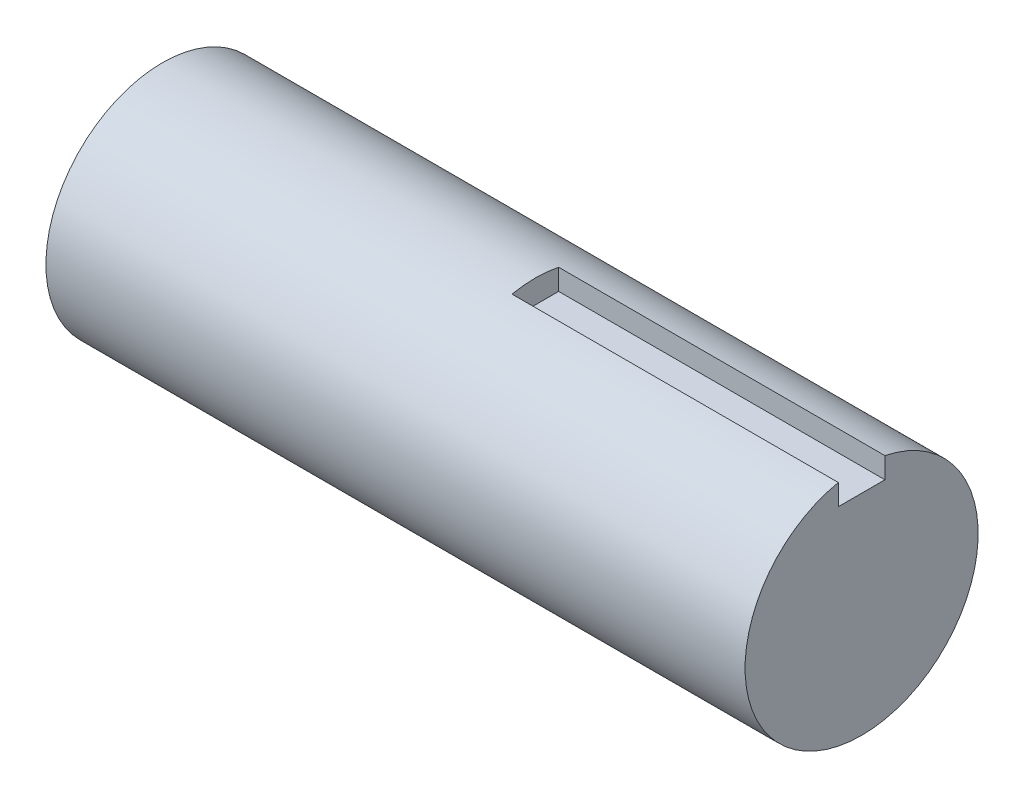
from build123d import *

# Parameters (mm, degrees)
SKETCH1_R           = 25
BOSS_EXTRUDE1_DEPTH = 150
SKETCH2_W           = 10
SKETCH2_H           = 10
CUT_EXTRUDE1_DEPTH  = 70


with BuildPart() as part:
    # Sketch1 → Boss-Extrude1 (new body)
    with BuildSketch(Plane(origin=(0, 0, 0), x_dir=(0, 0, -1), z_dir=(1, 0, 0))):
        Circle(SKETCH1_R)
    extrude(amount=BOSS_EXTRUDE1_DEPTH)

    # Sketch2 → Cut-Extrude1 (cut)
    with BuildSketch(Plane(origin=(150, 0, 0), x_dir=(0, 0, -1), z_dir=(1, 0, 0))):
        with Locations((0, 25)):
            Rectangle(SKETCH2_W, SKETCH2_H)
    extrude(amount=-CUT_EXTRUDE1_DEPTH, mode=Mode.SUBTRACT)


solid = part.part
